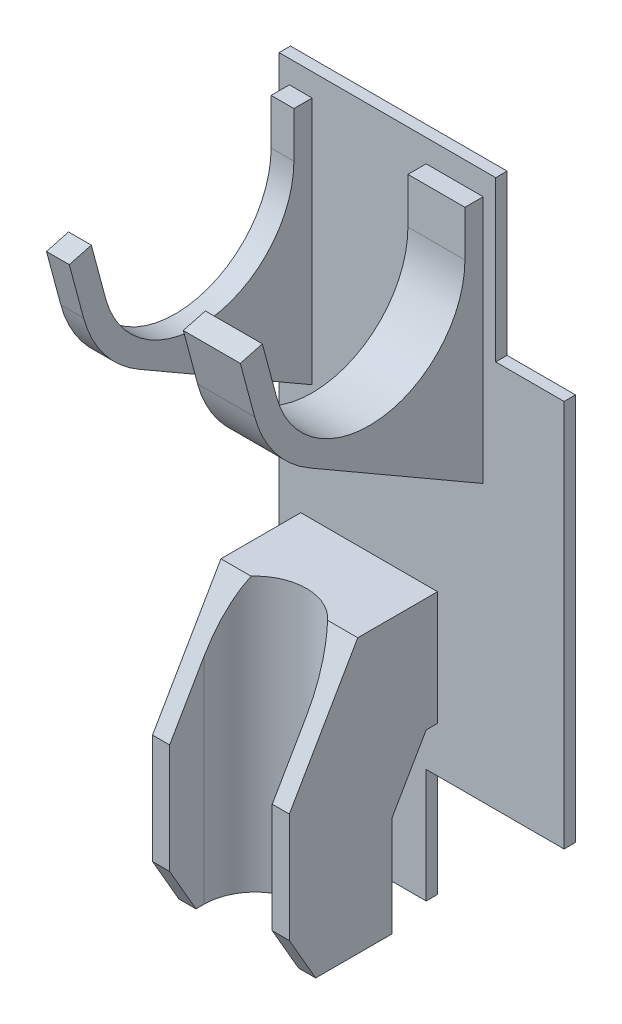
from build123d import *

# Parameters (mm, degrees)
BOSS_EXTRUDE1_START     = 10
BOSS_EXTRUDE1_DEPTH     = 5
BOSS_EXTRUDE2_START     = -25
BOSS_EXTRUDE2_DEPTH     = 10
BOSS_EXTRUDE3_START     = 50
BOSS_EXTRUDE3_DEPTH     = 25
BOSS_EXTRUDE6_START     = -100
BOSS_EXTRUDE6_DEPTH     = 120
CUT_EXTRUDE1_DEPTH      = 243.699343574
CUT_EXTRUDE1_DEPTH_BACK = 243.699343574


with BuildPart() as part:
    # Sketch2 → Boss-Extrude1 (new body)
    with BuildSketch(Plane(origin=(0, 0, -40), x_dir=(-1, 0, 0), z_dir=(0, 0, -1)).offset(BOSS_EXTRUDE1_START)):
        Polygon((-55.5, 0), (-85.5, 0), (-85.5, -170), (39.5, -170), (39.5, 70), (-55.5, 70), align=None)
    extrude(amount=BOSS_EXTRUDE1_DEPTH)

    # Sketch3 → Boss-Extrude2 (add)
    with BuildSketch(Plane(origin=(0, 0, 0), x_dir=(0, 0, -1), z_dir=(1, 0, 0)).offset(BOSS_EXTRUDE2_START)):
        with BuildLine():
            Line((-56.504171272, 49.963866159), (-50.228142967, 26.541409655))
            ThreePointArc((-50.228142967, 26.541409655), (-41.254373695, 8.344405692), (-26, -5.033320997))
            Line((-26, -5.033320997), (50, -48.911941455))
            Line((50, -48.911941455), (55, -48.911941455))
            Line((55, -48.911941455), (55, -28.911941455))
            Line((55, -28.911941455), (50, -28.911941455))
            Line((50, -28.911941455), (50, 30))
            Line((50, 30), (55, 30))
            Line((55, 30), (55, 60))
            Line((55, 60), (42, 60))
            Line((42, 60), (42, 40))
            ThreePointArc((42, 40), (5.482100073, -1.640684178), (-40.568884704, 29.129600106))
            Line((-40.568884704, 29.129600106), (-46.844913009, 52.55205661))
            Line((-46.844913009, 52.55205661), (-56.504171272, 49.963866159))
        make_face()
    extrude(amount=-BOSS_EXTRUDE2_DEPTH)

    # Sketch3<3> → Boss-Extrude3 (add)
    with BuildSketch(Plane(origin=(0, 0, 0), x_dir=(0, 0, -1), z_dir=(1, 0, 0)).offset(BOSS_EXTRUDE3_START)):
        with BuildLine():
            Line((-56.504171272, 49.963866159), (-50.228142967, 26.541409655))
            ThreePointArc((-50.228142967, 26.541409655), (-41.254373695, 8.344405692), (-26, -5.033320997))
            Line((-26, -5.033320997), (50, -48.911941455))
            Line((50, -48.911941455), (55, -48.911941455))
            Line((55, -48.911941455), (55, -28.911941455))
            Line((55, -28.911941455), (50, -28.911941455))
            Line((50, -28.911941455), (50, 30))
            Line((50, 30), (55, 30))
            Line((55, 30), (55, 60))
            Line((55, 60), (42, 60))
            Line((42, 60), (42, 40))
            ThreePointArc((42, 40), (5.482100073, -1.640684178), (-40.568884704, 29.129600106))
            Line((-40.568884704, 29.129600106), (-46.844913009, 52.55205661))
            Line((-46.844913009, 52.55205661), (-56.504171272, 49.963866159))
        make_face()
    extrude(amount=-BOSS_EXTRUDE3_DEPTH)

    # Sketch4 → Boss-Extrude6 (add)
    with BuildSketch(Plane(origin=(0, 0, 0), x_dir=(1, 0, 0), z_dir=(0, 1, 0)).offset(BOSS_EXTRUDE6_START)):
        with BuildLine():
            Line((22.5, -15), (30, -15))
            Line((30, -15), (30, 50))
            Line((30, 50), (25, 50))
            Line((25, 50), (25, 55))
            Line((25, 55), (-25, 55))
            Line((-25, 55), (-25, 50))
            Line((-25, 50), (-30, 50))
            Line((-30, 50), (-30, -15))
            Line((-30, -15), (-22.5, -15))
            Line((-22.5, -15), (-22.5, 0))
            ThreePointArc((-22.5, 0), (0, 22.5), (22.5, 0))
            Line((22.5, 0), (22.5, -15))
        make_face()
    extrude(amount=-BOSS_EXTRUDE6_DEPTH)

    # Sketch3<8> → Cut-Extrude1 (cut, two sides: drawn at the far end of the back side and taken through both)
    with BuildSketch(Plane(origin=(0, 0, 0), x_dir=(0, 0, -1), z_dir=(1, 0, 0)).offset(-CUT_EXTRUDE1_DEPTH_BACK)):
        Polygon((15, -100), (50, -100), (50, -80), (-50, -80), (-50, -245), (50, -245), (50, -150), (45, -150), (30, -175.980762114), (30, -220), (-3.452994616, -220), (-15, -200), (-15, -151.961524227), align=None)
    extrude(amount=CUT_EXTRUDE1_DEPTH + CUT_EXTRUDE1_DEPTH_BACK, mode=Mode.SUBTRACT)


solid = part.part
